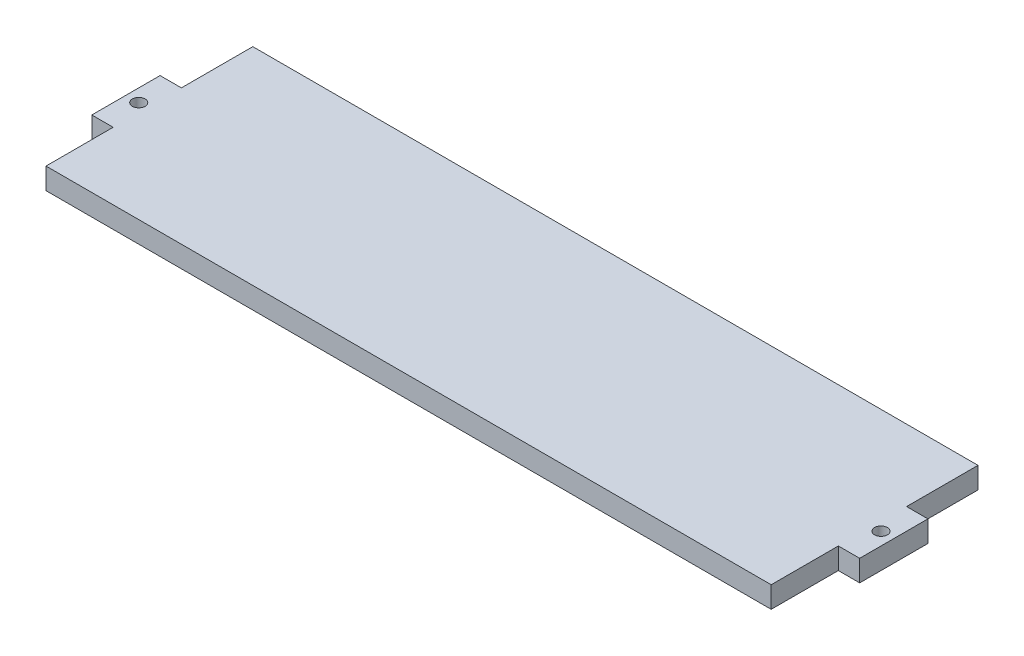
from build123d import *

# Parameters (mm, degrees)
CROQUIS1_W              = 180
CROQUIS1_H              = 16
SALIENTE_EXTRUIR1_DEPTH = 5
CROQUIS2_W              = 170
CROQUIS2_H              = 17.74
SALIENTE_EXTRUIR2_DEPTH = 5
CROQUIS3_R              = 1.5
CORTAR_EXTRUIR1_DEPTH   = 5
CROQUIS4_W              = 170
CROQUIS4_H              = 2
CORTAR_EXTRUIR2_DEPTH   = 94.741920185
CROQUIS5_W              = 170
CROQUIS5_H              = 1
CORTAR_EXTRUIR3_DEPTH   = 10


with BuildPart() as part:
    # Croquis1 → Saliente-Extruir1 (new body)
    with BuildSketch(Plane(origin=(0, 0, 0), x_dir=(1, 0, 0), z_dir=(0, 1, 0))):
        Rectangle(CROQUIS1_W, CROQUIS1_H)
    extrude(amount=SALIENTE_EXTRUIR1_DEPTH)

    # Croquis2 → Saliente-Extruir2 (add)
    with BuildSketch(Plane(origin=(0, 5, 0), x_dir=(1, 0, 0), z_dir=(0, 1, 0))):
        with Locations((0, 16.87)):
            Rectangle(CROQUIS2_W, CROQUIS2_H)
        with Locations((0, -16.87)):
            Rectangle(CROQUIS2_W, CROQUIS2_H)
    extrude(amount=-SALIENTE_EXTRUIR2_DEPTH)

    # Croquis3 → Cortar-Extruir1 (cut)
    with BuildSketch(Plane(origin=(0, 5, 0), x_dir=(1, 0, 0), z_dir=(0, 1, 0))):
        with Locations(Location((-87, 0, 0), (0, 0, 270))):
            Circle(CROQUIS3_R)
    cortar_extruir1 = extrude(amount=-CORTAR_EXTRUIR1_DEPTH, mode=Mode.SUBTRACT)

    # Simetría1: Cortar-Extruir1 across plane
    add(cortar_extruir1.mirror(Plane(origin=(0, 0, 0), x_dir=(0, 0, 1), z_dir=(1, 0, 0))), mode=Mode.SUBTRACT)

    # Croquis4 → Cortar-Extruir2 (cut, through all)
    with BuildSketch(Plane(origin=(0, 5, 0), x_dir=(1, 0, 0), z_dir=(0, 1, 0))):
        with Locations((0, -24.74)):
            Rectangle(CROQUIS4_W, CROQUIS4_H)
    extrude(amount=-CORTAR_EXTRUIR2_DEPTH, mode=Mode.SUBTRACT)

    # Croquis5 → Cortar-Extruir3 (cut)
    with BuildSketch(Plane(origin=(0, 5, 0), x_dir=(1, 0, 0), z_dir=(0, 1, 0))):
        with Locations((0, 25.24)):
            Rectangle(CROQUIS5_W, CROQUIS5_H)
    extrude(amount=-CORTAR_EXTRUIR3_DEPTH, mode=Mode.SUBTRACT)


solid = part.part
